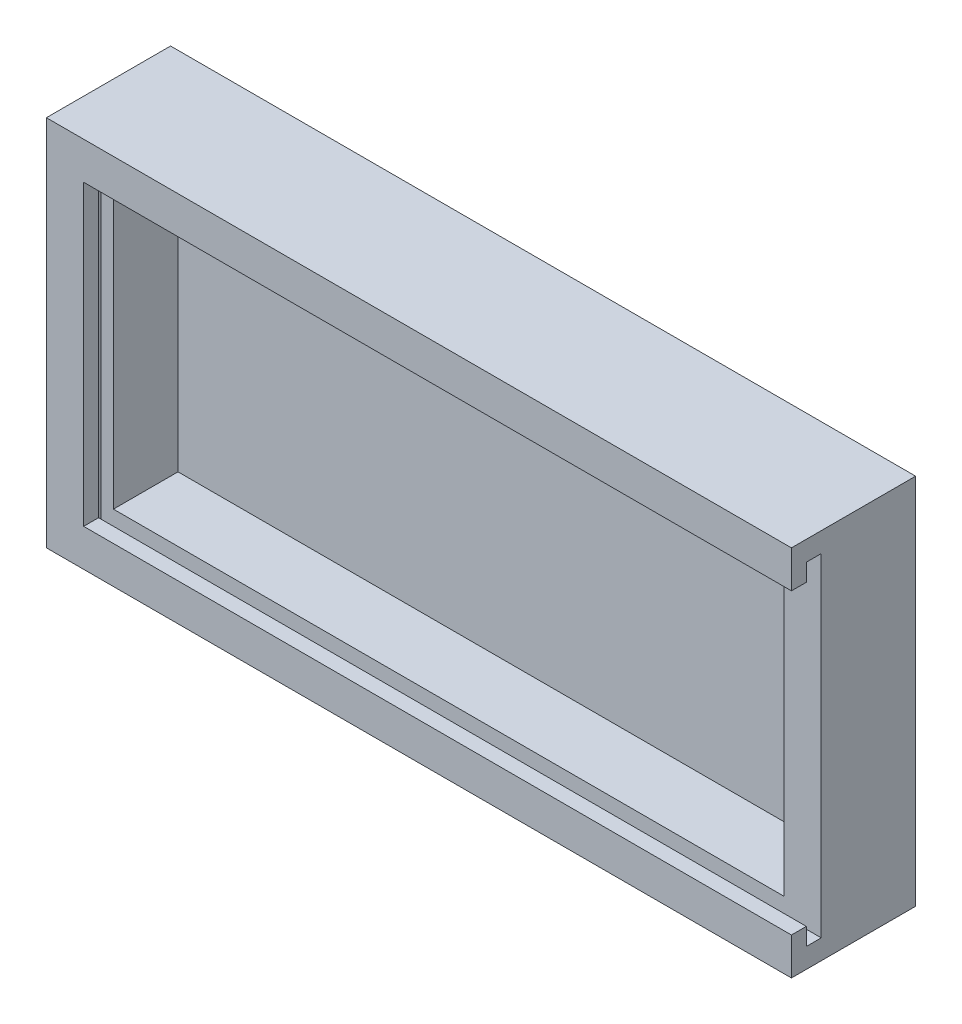
from build123d import *

# Parameters (mm, degrees)
SKETCH1_W           = 76.2
SKETCH1_H           = 38.1
BOSS_EXTRUDE1_DEPTH = 12.7
SKETCH3_W           = 34.29
SKETCH3_H           = 30.48
CUT_EXTRUDE1_DEPTH  = 9.652
SKETCH5_W           = 2.54
SKETCH5_H           = 30.48
CUT_EXTRUDE3_DEPTH  = 3.81
SKETCH6_W           = 1.524
SKETCH6_H           = 34.036
CUT_EXTRUDE4_DEPTH  = 73.66


with BuildPart() as part:
    # Sketch1 → Boss-Extrude1 (new body)
    with BuildSketch(Plane.XY):
        with Locations((38.1, 19.05)):
            Rectangle(SKETCH1_W, SKETCH1_H)
    extrude(amount=BOSS_EXTRUDE1_DEPTH)

    # Sketch3 → Cut-Extrude1 (cut)
    with BuildSketch(Plane.XY.offset(12.7)):
        with Locations((20.955, 19.05)):
            Rectangle(SKETCH3_W, SKETCH3_H)
        with Locations((55.245, 19.05)):
            Rectangle(SKETCH3_W, SKETCH3_H)
    extrude(amount=-CUT_EXTRUDE1_DEPTH, mode=Mode.SUBTRACT)

    # Sketch5 → Cut-Extrude3 (cut)
    with BuildSketch(Plane(origin=(76.2, 0, 0), x_dir=(0, 0, -1), z_dir=(1, 0, 0))):
        with Locations((-11.43, 19.05)):
            Rectangle(SKETCH5_W, SKETCH5_H)
    extrude(amount=-CUT_EXTRUDE3_DEPTH, mode=Mode.SUBTRACT)

    # Sketch6 → Cut-Extrude4 (cut)
    with BuildSketch(Plane(origin=(76.2, 0, 0), x_dir=(0, 0, -1), z_dir=(1, 0, 0))):
        with Locations((-10.414, 19.05)):
            Rectangle(SKETCH6_W, SKETCH6_H)
    extrude(amount=-CUT_EXTRUDE4_DEPTH, mode=Mode.SUBTRACT)


solid = part.part
